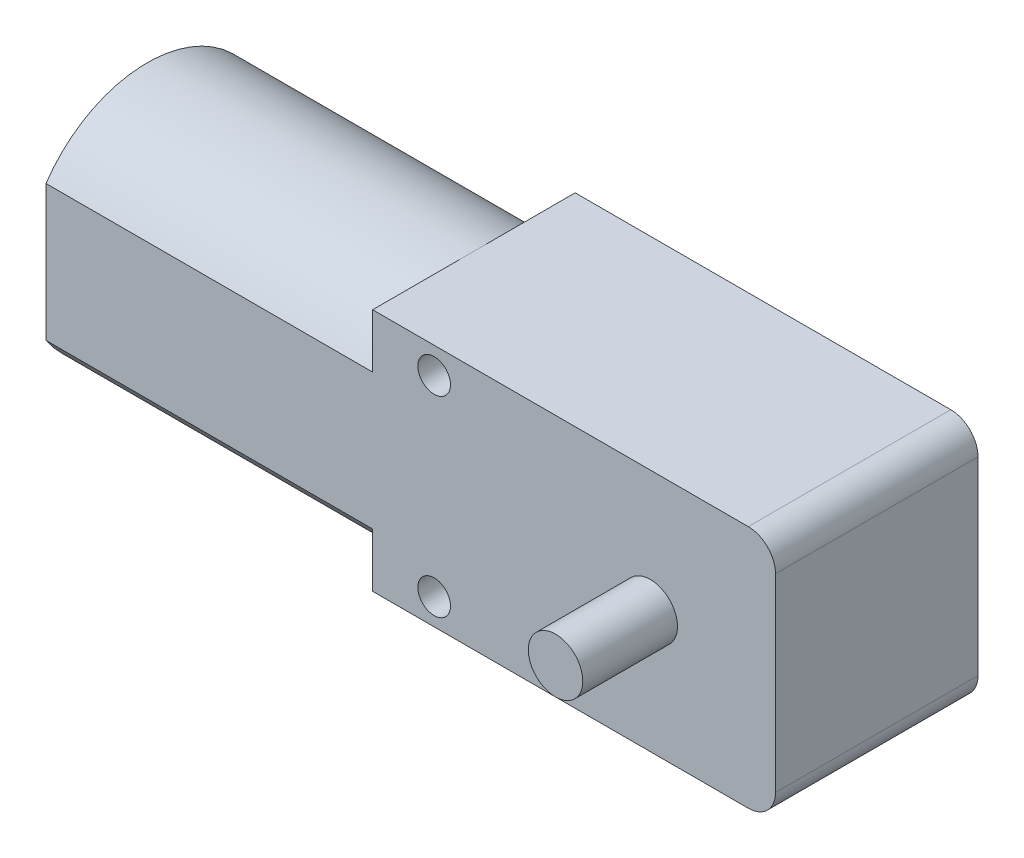
from build123d import *

# Parameters (mm, degrees)
SKETCH1_W                = 37
SKETCH1_H                = 22.4
BOSS_EXTRUDE1_DEPTH      = 18.6
BOSS_EXTRUDE2_DEPTH      = 30
BOSS_EXTRUDE3_DEPTH      = 8.7
BOSS_EXTRUDE3_DEPTH_BACK = 27.3
SKETCH3_R                = 2.5
SKETCH4_R                = 1.5
CUT_EXTRUDE1_DEPTH       = 18.6
FILLET2_R                = 2.5


with BuildPart() as part:
    # Sketch1 → Boss-Extrude1 (new body)
    with BuildSketch(Plane.XY):
        with Locations((18.5, 11.2)):
            Rectangle(SKETCH1_W, SKETCH1_H)
    extrude(amount=BOSS_EXTRUDE1_DEPTH)

    # Sketch2 → Boss-Extrude2 (add)
    with BuildSketch(Plane.ZY):
        with BuildLine():
            Line((0, 17.440993511), (0, 4.959006489))
            ThreePointArc((0, 4.959006489), (9.3, 0), (18.6, 4.959006489))
            Line((18.6, 4.959006489), (18.6, 17.440993511))
            ThreePointArc((18.6, 17.440993511), (9.3, 22.4), (0, 17.440993511))
        make_face()
    extrude(amount=BOSS_EXTRUDE2_DEPTH)

    # Sketch3 → Boss-Extrude3 (add, two sides: drawn at the far end of the back side and taken through both)
    with BuildSketch(Plane.XY.offset(18.6).offset(-BOSS_EXTRUDE3_DEPTH_BACK)):
        with Locations((25.5, 11.2)):
            Circle(SKETCH3_R)
    extrude(amount=BOSS_EXTRUDE3_DEPTH + BOSS_EXTRUDE3_DEPTH_BACK)

    # Sketch4 → Cut-Extrude1 (cut)
    with BuildSketch(Plane.XY.offset(18.6)):
        with Locations((5.65, 20)):
            Circle(SKETCH4_R)
        with Locations((5.65, 2.4)):
            Circle(SKETCH4_R)
    extrude(amount=-CUT_EXTRUDE1_DEPTH, mode=Mode.SUBTRACT)

    # Fillet2
    fillet2_edges = [part.edges().sort_by_distance(p)[0] for p in [
        (37, 22.4, 9.3),
        (37, 0, 9.3),
    ]]
    fillet(fillet2_edges, radius=FILLET2_R)


solid = part.part
